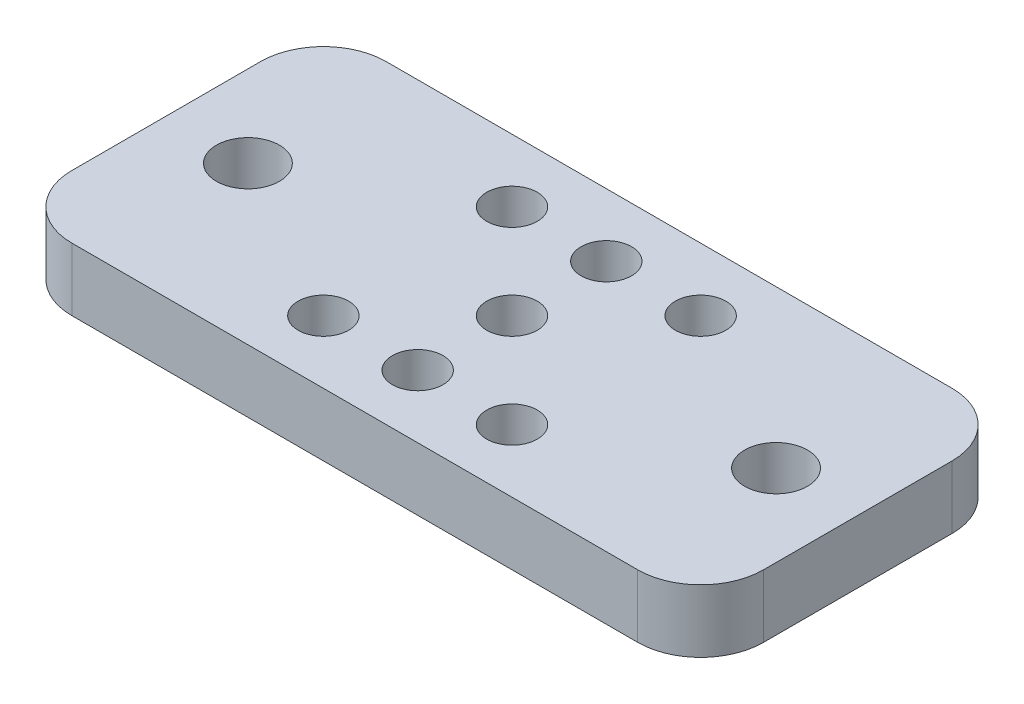
from build123d import *

# Parameters (mm, degrees)
SKETCH1_W           = 69.85
SKETCH1_H           = 31.75
BOSS_EXTRUDE1_DEPTH = 6.35
HOLE1_D             = 6.35
HOLE2_D             = 5.1054
HOLE2_CSINK_D       = 9.779
HOLE2_CSINK_ANGLE   = 100
FILLET1_R           = 6.35


with BuildPart() as part:
    # Sketch1 → Boss-Extrude1 (new body)
    with BuildSketch(Plane.XZ):
        Rectangle(SKETCH1_W, SKETCH1_H)
    extrude(amount=-BOSS_EXTRUDE1_DEPTH)

    # Hole1 (through all)
    with Locations(Plane(origin=(0, 6.35, 0), x_dir=(1, 0, 0), z_dir=(0, 1, 0))):
        with Locations((26.67, 0), (-26.67, 0)):
            Hole(HOLE1_D / 2)

    # Hole2 (through all)
    with Locations(Plane(origin=(0, 0, 0), x_dir=(-1, 0, 0), z_dir=(0, -1, 0))):
        with Locations((0, 0), (0, 9.525), (0, -9.525), (9.525, 9.525), (-9.525, 9.525), (-9.525, -9.525), (9.525, -9.525)):
            CounterSinkHole(HOLE2_D / 2, HOLE2_CSINK_D / 2, counter_sink_angle=HOLE2_CSINK_ANGLE)

    # Fillet1
    fillet1_edges = [part.edges().sort_by_distance(p)[0] for p in [
        (-34.925, 3.175, -15.875),
        (-34.925, 3.175, 15.875),
        (34.925, 3.175, 15.875),
        (34.925, 3.175, -15.875),
    ]]
    fillet(fillet1_edges, radius=FILLET1_R)


solid = part.part
